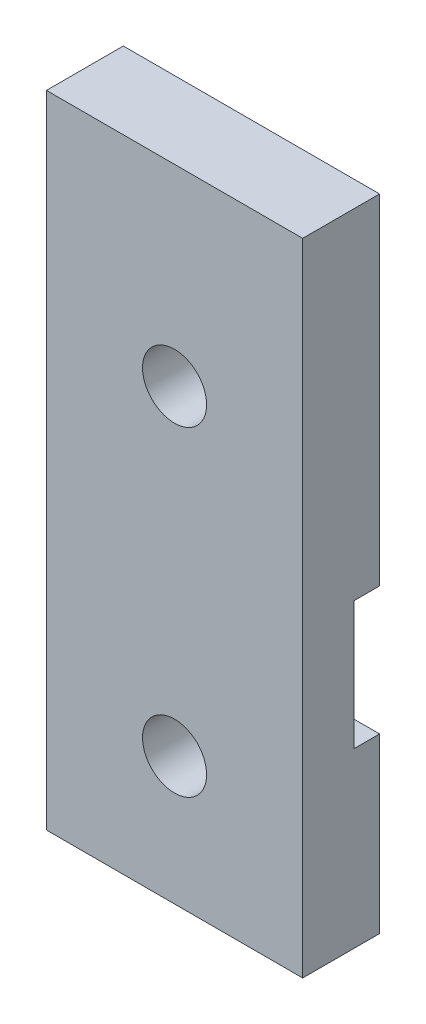
from build123d import *

# Parameters (mm, degrees)
ESBO_O1_W                = 20
ESBO_O1_H                = 50
RESSALTO_EXTRUS_O1_DEPTH = 6
ESBO_O2_R                = 2.5
CORTE_EXTRUS_O1_DEPTH    = 10
ESBO_O3_R                = 5
CORTE_EXTRUS_O2_DEPTH    = 2
ESBO_O4_W                = 3.25
ESBO_O4_H                = 10
CORTE_EXTRUS_O3_DEPTH    = 2
RESSALTO_EXTRUS_O2_START = -4
ESBO_O5_R                = 2.5
RESSALTO_EXTRUS_O2_DEPTH = 4


with BuildPart() as part:
    # Esboço1 → Ressalto-extrusão1 (new body)
    with BuildSketch(Plane.XY):
        with Locations((10, 25)):
            Rectangle(ESBO_O1_W, ESBO_O1_H)
    extrude(amount=RESSALTO_EXTRUS_O1_DEPTH)

    # Esboço2 → Corte-extrusão1 (cut)
    with BuildSketch(Plane(origin=(0, 0, 0), x_dir=(-1, 0, 0), z_dir=(0, 0, -1))):
        with Locations((-10, 35)):
            Circle(ESBO_O2_R)
        with Locations((-3.25, 18.5)):
            Circle(ESBO_O2_R)
        with Locations((-10, 10)):
            Circle(ESBO_O2_R)
    extrude(amount=-CORTE_EXTRUS_O1_DEPTH, mode=Mode.SUBTRACT)

    # Esboço3 → Corte-extrusão2 (cut)
    with BuildSketch(Plane.XY):
        with Locations((3.25, 18.5)):
            Circle(ESBO_O3_R)
        with Locations((16.75, 18.5)):
            Circle(ESBO_O3_R)
    extrude(amount=CORTE_EXTRUS_O2_DEPTH, mode=Mode.SUBTRACT)

    # Esboço4 → Corte-extrusão3 (cut)
    with BuildSketch(Plane(origin=(0, 0, 0), x_dir=(-1, 0, 0), z_dir=(0, 0, -1))):
        with Locations((-1.625, 18.5)):
            Rectangle(ESBO_O4_W, ESBO_O4_H)
        with Locations((-18.375, 18.5)):
            Rectangle(ESBO_O4_W, ESBO_O4_H)
    extrude(amount=-CORTE_EXTRUS_O3_DEPTH, mode=Mode.SUBTRACT)

    # Esboço5 → Ressalto-extrusão2 (add)
    with BuildSketch(Plane.XY.offset(6).offset(RESSALTO_EXTRUS_O2_START)):
        with Locations((3.25, 18.5)):
            Circle(ESBO_O5_R)
    extrude(amount=RESSALTO_EXTRUS_O2_DEPTH)


solid = part.part
